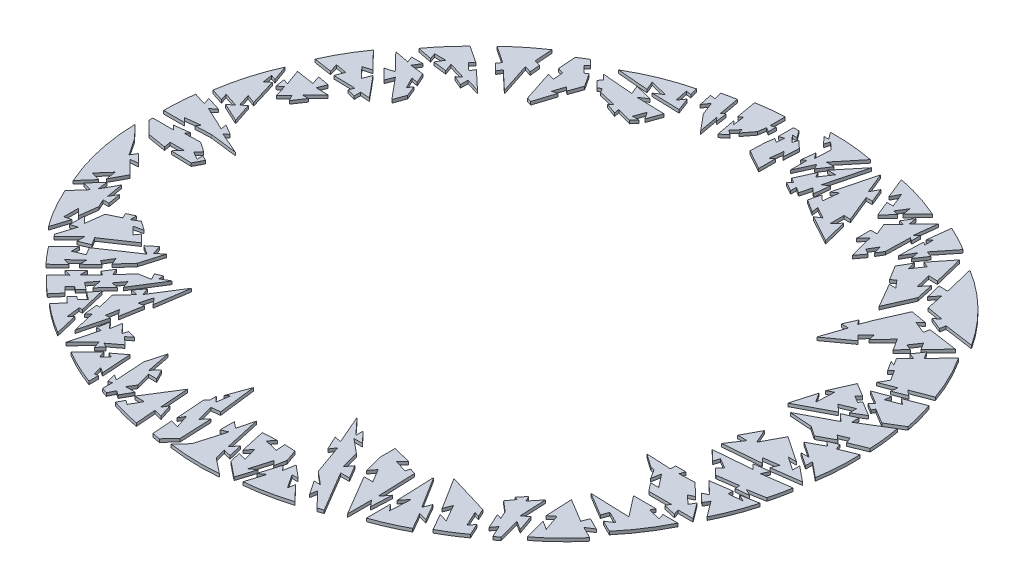
from build123d import *

# Parameters (mm, degrees)
BOSS_EXTRUDE1_DEPTH    = 10
BOSS_EXTRUDE1_2_DEPTH  = 10
BOSS_EXTRUDE1_3_DEPTH  = 10
BOSS_EXTRUDE1_4_DEPTH  = 10
BOSS_EXTRUDE1_5_DEPTH  = 10
BOSS_EXTRUDE1_6_DEPTH  = 10
BOSS_EXTRUDE1_7_DEPTH  = 10
BOSS_EXTRUDE1_8_DEPTH  = 10
BOSS_EXTRUDE1_9_DEPTH  = 10
BOSS_EXTRUDE1_10_DEPTH = 10
BOSS_EXTRUDE1_11_DEPTH = 10
BOSS_EXTRUDE1_12_DEPTH = 10
BOSS_EXTRUDE1_13_DEPTH = 10
BOSS_EXTRUDE1_14_DEPTH = 10
BOSS_EXTRUDE1_15_DEPTH = 10
BOSS_EXTRUDE1_16_DEPTH = 10
BOSS_EXTRUDE1_17_DEPTH = 10
BOSS_EXTRUDE1_18_DEPTH = 10
BOSS_EXTRUDE1_19_DEPTH = 10
BOSS_EXTRUDE1_20_DEPTH = 10
BOSS_EXTRUDE1_21_DEPTH = 10
BOSS_EXTRUDE1_22_DEPTH = 10
BOSS_EXTRUDE1_23_DEPTH = 10
BOSS_EXTRUDE1_24_DEPTH = 10
BOSS_EXTRUDE1_25_DEPTH = 10
BOSS_EXTRUDE1_26_DEPTH = 10
BOSS_EXTRUDE1_27_DEPTH = 10
BOSS_EXTRUDE1_28_DEPTH = 10
BOSS_EXTRUDE1_29_DEPTH = 10
BOSS_EXTRUDE1_30_DEPTH = 10
BOSS_EXTRUDE1_31_DEPTH = 10
BOSS_EXTRUDE1_32_DEPTH = 10
BOSS_EXTRUDE1_33_DEPTH = 10
BOSS_EXTRUDE1_34_DEPTH = 10
BOSS_EXTRUDE1_35_DEPTH = 10
BOSS_EXTRUDE1_36_DEPTH = 10
BOSS_EXTRUDE1_37_DEPTH = 10
BOSS_EXTRUDE1_38_DEPTH = 10
BOSS_EXTRUDE1_39_DEPTH = 10
BOSS_EXTRUDE1_40_DEPTH = 10
BOSS_EXTRUDE1_41_DEPTH = 10
BOSS_EXTRUDE1_42_DEPTH = 10
BOSS_EXTRUDE1_43_DEPTH = 10
BOSS_EXTRUDE1_44_DEPTH = 10
BOSS_EXTRUDE1_45_DEPTH = 10
BOSS_EXTRUDE1_46_DEPTH = 10
BOSS_EXTRUDE1_47_DEPTH = 10
BOSS_EXTRUDE1_48_DEPTH = 10
BOSS_EXTRUDE1_49_DEPTH = 10
BOSS_EXTRUDE1_50_DEPTH = 10
BOSS_EXTRUDE1_51_DEPTH = 10
BOSS_EXTRUDE1_52_DEPTH = 10
BOSS_EXTRUDE1_53_DEPTH = 10
BOSS_EXTRUDE1_54_DEPTH = 10


with BuildPart() as part:
    # Sketch4 → Boss-Extrude1 (new body)
    with BuildSketch(Plane(origin=(0, 0, 0), x_dir=(1, 0, 0), z_dir=(0, 1, 0))):
        Polygon((79.535918804, 1089.89984641), (71.877980686, 1117.12807083), (107.78416964, 1110.626891432), (97.090290147, 1083.298088284), (135.634843477, 1082.410305866), (96.116992272, 1041.040738869), (114.746180978, 1041.040738869), (89.831075163, 1004.643492825), (79.535918804, 1023.411317732), (55.159087046, 998.48275838), (43.82663475, 1035.844579587), (28.102215345, 1023.411317732), (23.557974907, 1054.154102939), (40.33938401, 1047.885655062), (21.89997497, 1098.69712794), align=None)
    extrude(amount=BOSS_EXTRUDE1_DEPTH)


with BuildPart() as body_2:
    # Sketch4 → Boss-Extrude1 2 (new body)
    with BuildSketch(Plane(origin=(0, 0, 0), x_dir=(1, 0, 0), z_dir=(0, 1, 0))):
        with BuildLine():
            Line((73.999706295, 1152.197257873), (66.341768176, 1179.425482293))
            Line((66.341768176, 1179.425482293), (102.247957131, 1172.924302895))
            Line((102.247957131, 1172.924302895), (91.554077638, 1145.595499747))
            Line((91.554077638, 1145.595499747), (160.33816672, 1144.011221304))
            Line((160.33816672, 1144.011221304), (154.163376558, 1128.231202))
            Line((154.163376558, 1128.231202), (180.669740076, 1121.171207079))
            Line((180.669740076, 1121.171207079), (180.669740076, 1142.237518264))
            Line((180.669740076, 1142.237518264), (210.604148879, 1140.084720315))
            Line((210.604148879, 1140.084720315), (154.163376557, 1207.984316562))
            Line((154.163376557, 1207.984316562), (143.671930057, 1181.618520373))
            Line((143.671930057, 1181.618520373), (111.463562372, 1214.997179591))
            Line((111.463562372, 1214.997179591), (138.632262091, 1222.924763886))
            Line((138.632262091, 1222.924763886), (84.294862654, 1279.236513565))
            ThreePointArc((84.294862654, 1279.236513565), (47.302401618, 1221.85451462), (16.363762461, 1160.994539403))
            Line((16.363762461, 1160.994539403), (73.999706295, 1152.197257873))
        make_face()
    extrude(amount=BOSS_EXTRUDE1_2_DEPTH)


with BuildPart() as body_3:
    # Sketch4 → Boss-Extrude1 3 (new body)
    with BuildSketch(Plane(origin=(0, 0, 0), x_dir=(1, 0, 0), z_dir=(0, 1, 0))):
        with BuildLine():
            Line((-9.812041904, 1090.609137792), (8.627367136, 1039.797664915))
            Line((8.627367136, 1039.797664915), (-8.154041967, 1046.066112792))
            Line((-8.154041967, 1046.066112792), (-3.609801529, 1015.323327585))
            Line((-3.609801529, 1015.323327585), (12.114617876, 1027.75658944))
            Line((12.114617876, 1027.75658944), (38.001535619, 942.410331887))
            Line((38.001535619, 942.410331887), (9.800772299, 952.698163999))
            Line((9.800772299, 952.698163999), (22.62263009, 912.692090883))
            Line((22.62263009, 912.692090883), (38.001535619, 925.530778152))
            Line((38.001535619, 925.530778152), (58.119058288, 864.527811369))
            Line((58.119058288, 864.527811369), (-1.285774091, 891.824054133))
            Line((-1.285774091, 891.824054133), (16.201884701, 906.423180311))
            Line((16.201884701, 906.423180311), (-28.71986797, 920.997359875))
            Line((-28.71986797, 920.997359875), (-21.329249717, 898.586566695))
            Line((-21.329249717, 898.586566695), (-61.151464902, 911.506278867))
            ThreePointArc((-61.151464902, 911.506278867), (-41.760391065, 1002.857465389), (-9.812041904, 1090.609137792))
        make_face()
    extrude(amount=BOSS_EXTRUDE1_3_DEPTH)


with BuildPart() as body_4:
    # Sketch4 → Boss-Extrude1 4 (new body)
    with BuildSketch(Plane(origin=(0, 0, 0), x_dir=(1, 0, 0), z_dir=(0, 1, 0))):
        with BuildLine():
            Line((41.755284669, 825.671648231), (-17.64954771, 852.967890995))
            Line((-17.64954771, 852.967890995), (-0.161888919, 867.567017173))
            Line((-0.161888919, 867.567017173), (-45.08364159, 882.141196738))
            Line((-45.08364159, 882.141196738), (-37.693023336, 859.730403558))
            Line((-37.693023336, 859.730403558), (-77.515238522, 872.650115729))
            ThreePointArc((-77.515238522, 872.650115729), (-82.48428339, 824.551990074), (-83.958923932, 776.220359295))
            Line((-83.958923932, 776.220359295), (-17.64954771, 776.220359295))
            Line((-17.64954771, 776.220359295), (-30.992426211, 789.759371705))
            Line((-30.992426211, 789.759371705), (17.187182846, 795.589047432))
            Line((17.187182846, 795.589047432), (8.800814094, 783.929695978))
            Line((8.800814094, 783.929695978), (59.708379146, 785.944138614))
            Line((59.708379146, 785.944138614), (146.47298558, 775.326660929))
            Line((146.47298558, 775.326660929), (76.111994767, 805.792094027))
            Line((76.111994767, 805.792094027), (88.81230015, 816.394620242))
            Line((88.81230015, 816.394620242), (55.819028546, 836.019147527))
            Line((55.819028546, 836.019147527), (59.708379146, 816.394620242))
            Line((59.708379146, 816.394620242), (41.755284669, 825.671648231))
        make_face()
    extrude(amount=BOSS_EXTRUDE1_4_DEPTH)


with BuildPart() as body_5:
    # Sketch4 → Boss-Extrude1 5 (new body)
    with BuildSketch(Plane(origin=(0, 0, 0), x_dir=(1, 0, 0), z_dir=(0, 1, 0))):
        with BuildLine():
            Line((63.201321177, 747.635270536), (12.293756125, 745.6208279))
            Line((12.293756125, 745.6208279), (20.680124878, 757.280179354))
            Line((20.680124878, 757.280179354), (-27.49948418, 751.450503627))
            Line((-27.49948418, 751.450503627), (-14.156605679, 737.911491217))
            Line((-14.156605679, 737.911491217), (-80.465981901, 737.911491217))
            ThreePointArc((-80.465981901, 737.911491217), (-80.403563977, 731.835012314), (-80.285839612, 725.759353269))
            Line((-80.285839612, 725.759353269), (-41.590699559, 686.519703991))
            Line((-41.590699559, 686.519703991), (18.40058862, 676.617529413))
            Line((18.40058862, 676.617529413), (14.850306746, 698.477622804))
            Line((14.850306746, 698.477622804), (59.311970577, 698.477622804))
            Line((59.311970577, 698.477622804), (40.209462988, 676.617529413))
            Line((40.209462988, 676.617529413), (105.564703129, 675.028249911))
            Line((105.564703129, 675.028249911), (121.204736715, 705.133504218))
            Line((121.204736715, 705.133504218), (104.625294103, 713.057913229))
            Line((104.625294103, 713.057913229), (104.625294103, 694.510073667))
            Line((104.625294103, 694.510073667), (79.604936799, 708.929120203))
            Line((79.604936799, 708.929120203), (94.472581963, 725.943018001))
            Line((94.472581963, 725.943018001), (63.201321177, 747.635270536))
        make_face()
    extrude(amount=BOSS_EXTRUDE1_5_DEPTH)


with BuildPart() as body_6:
    # Sketch4 → Boss-Extrude1 6 (new body)
    with BuildSketch(Plane(origin=(0, 0, 0), x_dir=(1, 0, 0), z_dir=(0, 1, 0))):
        with BuildLine():
            Line((-52.556600341, 652.205321241), (-91.251740394, 691.444970519))
            ThreePointArc((-91.251740394, 691.444970519), (-75.321911786, 561.590179275), (-34.373600353, 437.335352248))
            Line((-34.373600353, 437.335352248), (3.884405963, 480.667028893))
            Line((3.884405963, 480.667028893), (-25.122506461, 488.291307388))
            Line((-25.122506461, 488.291307388), (9.542828864, 527.553863014))
            Line((9.542828864, 527.553863014), (14.164803248, 495.389773573))
            Line((14.164803248, 495.389773573), (40.568243027, 543.711075942))
            Line((40.568243027, 543.711075942), (-2.831758419, 587.306096381))
            Line((-2.831758419, 587.306096381), (21.917416148, 589.397681421))
            Line((21.917416148, 589.397681421), (-4.757646195, 616.192608824))
            Line((-4.757646195, 616.192608824), (-16.190600365, 597.717205565))
            Line((-16.190600365, 597.717205565), (-52.556600341, 652.205321241))
        make_face()
    extrude(amount=BOSS_EXTRUDE1_6_DEPTH)


with BuildPart() as body_7:
    # Sketch4 → Boss-Extrude1 7 (new body)
    with BuildSketch(Plane(origin=(0, 0, 0), x_dir=(1, 0, 0), z_dir=(0, 1, 0))):
        with BuildLine():
            Line((-19.571437773, 396.330662033), (18.686568543, 439.662338678))
            Line((18.686568543, 439.662338678), (-10.320343881, 447.286617173))
            Line((-10.320343881, 447.286617173), (24.344991444, 486.549172799))
            Line((24.344991444, 486.549172799), (28.966965828, 454.385083358))
            Line((28.966965828, 454.385083358), (55.370405607, 502.706385727))
            Line((55.370405607, 502.706385727), (64.432670674, 448.572139031))
            Line((64.432670674, 448.572139031), (78.734381674, 472.433119398))
            Line((78.734381674, 472.433119398), (85.585678741, 431.506286776))
            Line((85.585678741, 431.506286776), (67.037582974, 431.506286776))
            Line((67.037582974, 431.506286776), (78.734381674, 406.220835552))
            Line((78.734381674, 406.220835552), (71.583526174, 348.230587538))
            Line((71.583526174, 348.230587538), (50.972862348, 368.129202053))
            Line((50.972862348, 368.129202053), (50.972862348, 321.225324983))
            Line((50.972862348, 321.225324983), (71.583526174, 327.479175259))
            Line((71.583526174, 327.479175259), (53.608531611, 270.245049446))
            ThreePointArc((53.608531611, 270.245049446), (13.566646481, 331.284376015), (-19.571437773, 396.330662033))
        make_face()
    extrude(amount=BOSS_EXTRUDE1_7_DEPTH)


with BuildPart() as body_8:
    # Sketch4 → Boss-Extrude1 8 (new body)
    with BuildSketch(Plane(origin=(0, 0, 0), x_dir=(1, 0, 0), z_dir=(0, 1, 0))):
        with BuildLine():
            Line((109.822945882, 394.728710427), (102.672090382, 336.738462413))
            Line((102.672090382, 336.738462413), (82.061426556, 356.637076928))
            Line((82.061426556, 356.637076928), (82.061426556, 309.733199858))
            Line((82.061426556, 309.733199858), (102.672090382, 315.987050134))
            Line((102.672090382, 315.987050134), (84.697095819, 258.752924321))
            ThreePointArc((84.697095819, 258.752924321), (87.136193554, 255.465641704), (89.595400608, 252.193375603))
            Line((89.595400608, 252.193375603), (139.578412803, 301.336922603))
            Line((139.578412803, 301.336922603), (139.578412803, 275.103258044))
            Line((139.578412803, 275.103258044), (173.135786031, 289.249418825))
            Line((173.135786031, 289.249418825), (158.264865702, 313.424426381))
            Line((158.264865702, 313.424426381), (247.693361962, 373.844534244))
            Line((247.693361962, 373.844534244), (223.355119625, 398.598520021))
            Line((223.355119625, 398.598520021), (212.025749305, 382.407264927))
            Line((212.025749305, 382.407264927), (188.552899834, 406.281075284))
            Line((188.552899834, 406.281075284), (216.530458883, 413.302784209))
            Line((216.530458883, 413.302784209), (187.396758953, 433.688262256))
            Line((187.396758953, 433.688262256), (165.167369095, 420.014161648))
            Line((165.167369095, 420.014161648), (165.167369095, 441.003339135))
            Line((165.167369095, 441.003339135), (140.750323542, 429.254882222))
            Line((140.750323542, 429.254882222), (148.425803186, 413.302784213))
            Line((148.425803186, 413.302784213), (109.822945882, 394.728710427))
        make_face()
    extrude(amount=BOSS_EXTRUDE1_8_DEPTH)


with BuildPart() as body_9:
    # Sketch4 → Boss-Extrude1 9 (new body)
    with BuildSketch(Plane(origin=(0, 0, 0), x_dir=(1, 0, 0), z_dir=(0, 1, 0))):
        with BuildLine():
            Line((177.328299857, 276.862381203), (287.560333038, 351.337874064))
            Line((287.560333038, 351.337874064), (259.255499242, 369.719030106))
            Line((259.255499242, 369.719030106), (287.056489781, 392.692837047))
            Line((287.056489781, 392.692837047), (295.817750845, 363.640182742))
            Line((295.817750845, 363.640182742), (318.729469632, 382.573659352))
            Line((318.729469632, 382.573659352), (297.315557908, 310.622095472))
            Line((297.315557908, 310.622095472), (259.255499242, 268.030936848))
            Line((259.255499242, 268.030936848), (250.229433273, 289.32651616))
            Line((250.229433273, 289.32651616), (231.089183461, 259.133799897))
            Line((231.089183461, 259.133799897), (244.735949045, 250.482623894))
            Line((244.735949045, 250.482623894), (207.616333989, 215.631330425))
            Line((207.616333989, 215.631330425), (207.616333989, 238.541212866))
            Line((207.616333989, 238.541212866), (170.990191574, 204.153236698))
            Line((170.990191574, 204.153236698), (192.228086744, 197.832506642))
            Line((192.228086744, 197.832506642), (153.904476449, 161.93124548))
            ThreePointArc((153.904476449, 161.93124548), (130.575141478, 188.186006118), (108.658834763, 215.631330425))
            Line((108.658834763, 215.631330425), (158.641846957, 264.774877425))
            Line((158.641846957, 264.774877425), (158.641846957, 238.541212866))
            Line((158.641846957, 238.541212866), (192.199220185, 252.687373647))
            Line((192.199220185, 252.687373647), (177.328299857, 276.862381203))
        make_face()
    extrude(amount=BOSS_EXTRUDE1_9_DEPTH)


with BuildPart() as body_10:
    # Sketch4 → Boss-Extrude1 10 (new body)
    with BuildSketch(Plane(origin=(0, 0, 0), x_dir=(1, 0, 0), z_dir=(0, 1, 0))):
        with BuildLine():
            Line((327.70308918, 282.051288062), (364.751276434, 288.716386461))
            Line((364.751276434, 288.716386461), (354.124045758, 308.711681656))
            Line((354.124045758, 308.711681656), (375.31883397, 317.274412339))
            Line((375.31883397, 317.274412339), (375.31883397, 302.046583258))
            Line((375.31883397, 302.046583258), (402.174953977, 317.274412339))
            Line((402.174953977, 317.274412339), (341.827496185, 221.911816484))
            Line((341.827496185, 221.911816484), (333.187935626, 244.60034727))
            Line((333.187935626, 244.60034727), (311.480436944, 216.033324286))
            Line((311.480436944, 216.033324286), (332.310723281, 211.70060793))
            Line((332.310723281, 211.70060793), (294.437547572, 171.350848224))
            Line((294.437547572, 171.350848224), (287.39528718, 201.184587801))
            Line((287.39528718, 201.184587801), (265.981424309, 173.003988932))
            Line((265.981424309, 173.003988932), (288.204302366, 156.117276712))
            Line((288.204302366, 156.117276712), (271.512078315, 138.333522991))
            Line((271.512078315, 138.333522991), (261.476714732, 145.959191296))
            Line((261.476714732, 145.959191296), (246.191839965, 129.674815549))
            Line((246.191839965, 129.674815549), (264.310936897, 112.667830952))
            Line((264.310936897, 112.667830952), (238.114039669, 81.973024041))
            ThreePointArc((238.114039669, 81.973024041), (210.486494325, 106.916254166), (184.292007721, 133.36043807))
            Line((184.292007721, 133.36043807), (222.615618017, 169.261699232))
            Line((222.615618017, 169.261699232), (201.377722846, 175.582429288))
            Line((201.377722846, 175.582429288), (238.003865261, 209.970405456))
            Line((238.003865261, 209.970405456), (238.003865261, 187.060523016))
            Line((238.003865261, 187.060523016), (275.123480318, 221.911816484))
            Line((275.123480318, 221.911816484), (261.476714733, 230.562992488))
            Line((261.476714733, 230.562992488), (280.616964545, 260.75570875))
            Line((280.616964545, 260.75570875), (289.643030515, 239.460129438))
            Line((289.643030515, 239.460129438), (327.70308918, 282.051288062))
        make_face()
    extrude(amount=BOSS_EXTRUDE1_10_DEPTH)


with BuildPart() as body_11:
    # Sketch4 → Boss-Extrude1 11 (new body)
    with BuildSketch(Plane(origin=(0, 0, 0), x_dir=(1, 0, 0), z_dir=(0, 1, 0))):
        with BuildLine():
            Line((318.166013938, 177.340107138), (337.825903788, 94.053207594))
            Line((337.825903788, 94.053207594), (327.915054147, 94.053207594))
            Line((327.915054147, 94.053207594), (332.870478967, 49.672476542))
            Line((332.870478967, 49.672476542), (344.974139966, 63.770513588))
            Line((344.974139966, 63.770513588), (362.02301673, -8.455124358))
            ThreePointArc((362.02301673, -8.455124358), (314.023937786, 22.836468328), (268.884766427, 58.128543378))
            Line((268.884766427, 58.128543378), (295.081663655, 88.823350289))
            Line((295.081663655, 88.823350289), (276.962566723, 105.830334886))
            Line((276.962566723, 105.830334886), (292.24744149, 122.114710633))
            Line((292.24744149, 122.114710633), (302.282805073, 114.489042328))
            Line((302.282805073, 114.489042328), (318.975029125, 132.272796048))
            Line((318.975029125, 132.272796048), (296.752151067, 149.159508269))
            Line((296.752151067, 149.159508269), (318.166013938, 177.340107138))
        make_face()
    extrude(amount=BOSS_EXTRUDE1_11_DEPTH)


with BuildPart() as body_12:
    # Sketch4 → Boss-Extrude1 12 (new body)
    with BuildSketch(Plane(origin=(0, 0, 0), x_dir=(1, 0, 0), z_dir=(0, 1, 0))):
        Polygon((440.498310755, 119.89124082), (434.362277889, 83.862911401), (416.970747284, 104.637864354), (410.557984152, 66.984685558), (425.666512586, 66.984685558), (402.567799624, -22.311145191), (454.368370737, 31.63761816), (461.788637842, 9.142700204), (480.245411042, 28.364883825), (465.648935655, 35.81645571), (503.643461314, 64.677028911), (480.245411042, 87.14338943), (498.004315831, 100.633021495), (472.947173349, 108.258689801), (467.859020429, 91.539555481), align=None)
    extrude(amount=BOSS_EXTRUDE1_12_DEPTH)


with BuildPart() as body_13:
    # Sketch4 → Boss-Extrude1 13 (new body)
    with BuildSketch(Plane(origin=(0, 0, 0), x_dir=(1, 0, 0), z_dir=(0, 1, 0))):
        Polygon((453.586838126, 328.489580376), (393.239380335, 233.126984521), (384.599819775, 255.815515307), (362.892321093, 227.248492323), (383.722607431, 222.915775967), (345.849431722, 182.566016261), (358.467061179, 129.112856295), (348.556211538, 129.112856295), (353.511636359, 84.732125242), (365.615297358, 98.830162288), (382.664174122, 26.604524342), (405.762887084, 115.900355091), (390.654358649, 115.900355091), (397.067121782, 153.553533886), (414.458652386, 132.778580934), (426.73071812, 204.835239772), (408.78101236, 201.353975417), (420.136292413, 241.778160525), (437.375157329, 221.185573494), align=None)
    extrude(amount=BOSS_EXTRUDE1_13_DEPTH)


with BuildPart() as body_14:
    # Sketch4 → Boss-Extrude1 14 (new body)
    with BuildSketch(Plane(origin=(0, 0, 0), x_dir=(1, 0, 0), z_dir=(0, 1, 0))):
        with BuildLine():
            Line((489.742094149, 12.273940855), (437.941523036, -41.674822496))
            ThreePointArc((437.941523036, -41.674822496), (491.16768175, -70.03860688), (546.736395575, -93.483143126))
            Line((546.736395575, -93.483143126), (546.736395575, -62.19675071))
            Line((546.736395575, -62.19675071), (535.564101531, -65.135540554))
            Line((535.564101531, -65.135540554), (528.248609071, -37.324490024))
            Line((528.248609071, -37.324490024), (545.156477876, -48.127129486))
            Line((545.156477876, -48.127129486), (539.017184726, 45.313351605))
            Line((539.017184726, 45.313351605), (501.022659067, 16.452778404))
            Line((501.022659067, 16.452778404), (515.619134454, 9.00120652))
            Line((515.619134454, 9.00120652), (497.162361254, -10.220977101))
            Line((497.162361254, -10.220977101), (489.742094149, 12.273940855))
        make_face()
    extrude(amount=BOSS_EXTRUDE1_14_DEPTH)


with BuildPart() as body_15:
    # Sketch4 → Boss-Extrude1 15 (new body)
    with BuildSketch(Plane(origin=(0, 0, 0), x_dir=(1, 0, 0), z_dir=(0, 1, 0))):
        with BuildLine():
            Line((597.756001684, 108.00042712), (581.032826563, 47.251068685))
            Line((581.032826563, 47.251068685), (587.172119713, -46.189412406))
            Line((587.172119713, -46.189412406), (570.264250907, -35.386772944))
            Line((570.264250907, -35.386772944), (577.579743368, -63.197823474))
            Line((577.579743368, -63.197823474), (588.752037411, -60.259033631))
            Line((588.752037411, -60.259033631), (588.752037411, -91.545426046))
            ThreePointArc((588.752037411, -91.545426046), (597.794046725, -94.813854886), (606.88218713, -97.951730517))
            Line((606.88218713, -97.951730517), (617.905643605, -75.652462449))
            Line((617.905643605, -75.652462449), (631.309529351, -85.114807861))
            Line((631.309529351, -85.114807861), (651.337142246, -49.946424082))
            Line((651.337142246, -49.946424082), (620.742873159, -49.946424082))
            Line((620.742873159, -49.946424082), (635.69831428, -26.122390484))
            Line((635.69831428, -26.122390484), (622.559710316, 21.30934487))
            Line((622.559710316, 21.30934487), (648.836918243, 21.30934487))
            Line((648.836918243, 21.30934487), (632.459338173, 53.612416389))
            Line((632.459338173, 53.612416389), (612.66008246, 32.48853253))
            Line((612.66008246, 32.48853253), (597.756001684, 108.00042712))
        make_face()
    extrude(amount=BOSS_EXTRUDE1_15_DEPTH)


with BuildPart() as body_16:
    # Sketch4 → Boss-Extrude1 16 (new body)
    with BuildSketch(Plane(origin=(0, 0, 0), x_dir=(1, 0, 0), z_dir=(0, 1, 0))):
        with BuildLine():
            Line((647.780592753, -109.705430187), (658.804049228, -87.406162119))
            Line((658.804049228, -87.406162119), (672.207934973, -96.868507531))
            Line((672.207934973, -96.868507531), (692.235547869, -61.700123752))
            Line((692.235547869, -61.700123752), (661.641278782, -61.700123752))
            Line((661.641278782, -61.700123752), (726.649923722, 41.858716719))
            Line((726.649923722, 41.858716719), (733.495541865, -51.490805086))
            Line((733.495541865, -51.490805086), (744.71711675, -31.785778121))
            Line((744.71711675, -31.785778121), (758.630692934, -74.951523144))
            Line((758.630692934, -74.951523144), (733.495541865, -68.638419609))
            Line((733.495541865, -68.638419609), (738.237609782, -133.303109214))
            ThreePointArc((738.237609782, -133.303109214), (692.595554153, -123.089520451), (647.780592753, -109.705430187))
        make_face()
    extrude(amount=BOSS_EXTRUDE1_16_DEPTH)


with BuildPart() as body_17:
    # Sketch4 → Boss-Extrude1 17 (new body)
    with BuildSketch(Plane(origin=(0, 0, 0), x_dir=(1, 0, 0), z_dir=(0, 1, 0))):
        with BuildLine():
            Line((782.552631596, 38.688364905), (789.398249739, -54.6611569))
            Line((789.398249739, -54.6611569), (800.619824624, -34.956129935))
            Line((800.619824624, -34.956129935), (814.533400807, -78.121874958))
            Line((814.533400807, -78.121874958), (789.398249739, -71.808771423))
            Line((789.398249739, -71.808771423), (794.140317656, -136.473461028))
            ThreePointArc((794.140317656, -136.473461028), (806.599402219, -138.684513709), (819.098154532, -140.659034599))
            Line((819.098154532, -140.659034599), (851.265580891, -106.46947753))
            Line((851.265580891, -106.46947753), (846.938956692, -3.63292302))
            Line((846.938956692, -3.63292302), (828.52228932, -23.207311505))
            Line((828.52228932, -23.207311505), (814.533400807, 28.882089071))
            Line((814.533400807, 28.882089071), (842.511177833, 32.327017201))
            Line((842.511177833, 32.327017201), (827.792816748, 151.861303279))
            Line((827.792816748, 151.861303279), (802.578753671, 82.068276866))
            Line((802.578753671, 82.068276866), (814.533400807, 93.076375636))
            Line((814.533400807, 93.076375636), (807.922846758, 51.532893876))
            Line((807.922846758, 51.532893876), (792.498976172, 68.283009785))
            Line((792.498976172, 68.283009785), (792.498976172, 47.847175052))
            Line((792.498976172, 47.847175052), (782.552631596, 38.688364905))
        make_face()
    extrude(amount=BOSS_EXTRUDE1_17_DEPTH)


with BuildPart() as body_18:
    # Sketch4 → Boss-Extrude1 18 (new body)
    with BuildSketch(Plane(origin=(0, 0, 0), x_dir=(1, 0, 0), z_dir=(0, 1, 0))):
        with BuildLine():
            Line((884.602016416, -102.333419462), (852.434590057, -136.522976531))
            ThreePointArc((852.434590057, -136.522976531), (931.784660081, -143.484991445), (1011.399113101, -140.946855336))
            Line((1011.399113101, -140.946855336), (963.053557631, -102.333419461))
            Line((963.053557631, -102.333419461), (954.348325388, -67.672713355))
            Line((954.348325388, -67.672713355), (979.224438091, -73.985816891))
            Line((979.224438091, -73.985816891), (968.383117253, -30.820071867))
            Line((968.383117253, -30.820071867), (951.144948085, -52.402944379))
            Line((951.144948085, -52.402944379), (925.387529898, 63.325601839))
            Line((925.387529898, 63.325601839), (911.986774571, 10.521351454))
            Line((911.986774571, 10.521351454), (891.594594978, 26.80851811))
            Line((891.594594978, 26.80851811), (891.594594978, -19.071253437))
            Line((891.594594978, -19.071253437), (911.98677457, -9.642090648))
            Line((911.98677457, -9.642090648), (884.602016416, -102.333419462))
        make_face()
    extrude(amount=BOSS_EXTRUDE1_18_DEPTH)


with BuildPart() as body_19:
    # Sketch4 → Boss-Extrude1 19 (new body)
    with BuildSketch(Plane(origin=(0, 0, 0), x_dir=(1, 0, 0), z_dir=(0, 1, 0))):
        Polygon((1044.57890519, -126.957258536), (996.23334972, -88.343822661), (987.528117477, -53.683116555), (1012.40423018, -59.996220091), (1001.562909342, -16.830475067), (984.324740174, -38.413347579), (966.69483959, 40.79811491), (1012.40423018, 44.001835341), (996.23334972, 24.510948253), (1038.093918319, 14.492731847), (1036.025658022, 44.001835341), (1069.991151147, 42.399975125), (1083.462745391, 4.347506152), (1076.717688071, -32.185169561), (1063.014065545, -16.830475067), (1043.786001521, -81.913204478), (1063.014065546, -68.041575069), align=None)
    extrude(amount=BOSS_EXTRUDE1_19_DEPTH)


with BuildPart() as body_20:
    # Sketch4 → Boss-Extrude1 20 (new body)
    with BuildSketch(Plane(origin=(0, 0, 0), x_dir=(1, 0, 0), z_dir=(0, 1, 0))):
        with BuildLine():
            Line((1110.807699052, 5.503034447), (1104.062641732, -31.029641267))
            Line((1104.062641732, -31.029641267), (1090.359019206, -15.674946773))
            Line((1090.359019206, -15.674946773), (1071.130955182, -80.757676183))
            Line((1071.130955182, -80.757676183), (1090.359019207, -66.886046775))
            Line((1090.359019207, -66.886046775), (1071.923858851, -125.801730242))
            ThreePointArc((1071.923858851, -125.801730242), (1141.908204974, -115.614287968), (1210.422219434, -98.08081983))
            Line((1210.422219434, -98.08081983), (1164.051494151, -49.70765153))
            Line((1164.051494151, -49.70765153), (1160.065743558, -71.295330772))
            Line((1160.065743558, -71.295330772), (1130.953952711, -28.119972287))
            Line((1130.953952711, -28.119972287), (1151.100206369, -28.119972287))
            Line((1151.100206369, -28.119972287), (1110.807699052, 5.503034447))
        make_face()
    extrude(amount=BOSS_EXTRUDE1_20_DEPTH)


with BuildPart() as body_21:
    # Sketch4 → Boss-Extrude1 21 (new body)
    with BuildSketch(Plane(origin=(0, 0, 0), x_dir=(1, 0, 0), z_dir=(0, 1, 0))):
        with BuildLine():
            Line((1076.268303777, 235.261251134), (1116.740927045, 141.457772216))
            Line((1116.740927045, 141.457772216), (1095.947036983, 145.296964874))
            Line((1095.947036983, 145.296964874), (1116.740927045, 100.724720291))
            Line((1116.740927045, 100.724720291), (1129.565495047, 119.483072291))
            Line((1129.565495047, 119.483072291), (1163.497699448, 23.63664671))
            Line((1163.497699448, 23.63664671), (1203.790206765, -9.986360023))
            Line((1203.790206765, -9.986360023), (1183.643953107, -9.986360023))
            Line((1183.643953107, -9.986360023), (1212.755743954, -53.161718508))
            Line((1212.755743954, -53.161718508), (1216.741494547, -31.574039266))
            Line((1216.741494547, -31.574039266), (1263.11221983, -79.947207567))
            ThreePointArc((1263.11221983, -79.947207567), (1271.745637186, -77.178687897), (1280.340661817, -74.293181357))
            Line((1280.340661817, -74.293181357), (1203.790206765, 54.979276472))
            Line((1203.790206765, 54.979276472), (1231.898535757, 54.979276472))
            Line((1231.898535757, 54.979276472), (1206.61987732, 97.667909798))
            Line((1206.61987732, 97.667909798), (1190.617232161, 76.323593134))
            Line((1190.617232161, 76.323593134), (1175.434449447, 133.785551215))
            Line((1175.434449447, 133.785551215), (1129.565495046, 171.520084351))
            Line((1129.565495046, 171.520084351), (1156.752642128, 171.520084351))
            Line((1156.752642128, 171.520084351), (1123.820955578, 206.824411658))
            Line((1123.820955578, 206.824411658), (1123.820955578, 183.397606506))
            Line((1123.820955578, 183.397606506), (1076.268303777, 235.261251134))
        make_face()
    extrude(amount=BOSS_EXTRUDE1_21_DEPTH)


with BuildPart() as body_22:
    # Sketch4 → Boss-Extrude1 22 (new body)
    with BuildSketch(Plane(origin=(0, 0, 0), x_dir=(1, 0, 0), z_dir=(0, 1, 0))):
        Polygon((1328.253317478, -47.551346462), (1251.702862426, 81.721111367), (1279.811191418, 81.721111367), (1254.532532981, 124.409744694), (1238.529887822, 103.06542803), (1223.347105108, 160.52738611), (1223.347105108, 210.139441401), (1280.930053831, 195.290704916), (1260.668399615, 175.839245837), (1301.273210362, 163.639073676), (1305.429896458, 177.473423718), (1323.517499978, 172.038799769), (1328.253317478, 50.378481605), (1348.364325266, 76.079141157), (1345.281859295, 9.495473421), (1328.253317478, 29.200500386), align=None)
    extrude(amount=BOSS_EXTRUDE1_22_DEPTH)


with BuildPart() as body_23:
    # Sketch4 → Boss-Extrude1 23 (new body)
    with BuildSketch(Plane(origin=(0, 0, 0), x_dir=(1, 0, 0), z_dir=(0, 1, 0))):
        with BuildLine():
            Line((1370.214663969, -28.854267708), (1370.214663969, 47.89757914))
            Line((1370.214663969, 47.89757914), (1387.243205787, 28.192552175))
            Line((1387.243205787, 28.192552175), (1390.325671758, 94.776219911))
            Line((1390.325671758, 94.776219911), (1370.214663969, 69.075560359))
            Line((1370.214663969, 69.075560359), (1365.478846469, 190.735878523))
            Line((1365.478846469, 190.735878523), (1429.062215955, 89.239002461))
            Line((1429.062215955, 89.239002461), (1439.184850757, 115.180726276))
            Line((1439.184850757, 115.180726276), (1470.040145767, 61.484386043))
            Line((1470.040145767, 61.484386043), (1442.751358467, 69.07556036))
            Line((1442.751358467, 69.07556036), (1473.006681651, 16.42332913))
            ThreePointArc((1473.006681651, 16.42332913), (1422.56457242, -8.381071539), (1370.214663969, -28.854267708))
        make_face()
    extrude(amount=BOSS_EXTRUDE1_23_DEPTH)


with BuildPart() as body_24:
    # Sketch4 → Boss-Extrude1 24 (new body)
    with BuildSketch(Plane(origin=(0, 0, 0), x_dir=(1, 0, 0), z_dir=(0, 1, 0))):
        with BuildLine():
            Line((1400.966120484, 220.398801671), (1464.54948997, 118.901925608))
            Line((1464.54948997, 118.901925608), (1474.672124772, 144.843649424))
            Line((1474.672124772, 144.843649424), (1505.527419781, 91.147309191))
            Line((1505.527419781, 91.147309191), (1478.238632482, 98.738483507))
            Line((1478.238632482, 98.738483507), (1508.493955665, 46.086252277))
            ThreePointArc((1508.493955665, 46.086252277), (1545.878602464, 68.071763614), (1581.756876595, 92.438215354))
            Line((1581.756876595, 92.438215354), (1564.492489315, 130.081113269))
            Line((1564.492489315, 130.081113269), (1550.776175067, 111.804238677))
            Line((1550.776175067, 111.804238677), (1528.505009856, 160.363807277))
            Line((1528.505009856, 160.363807277), (1544.531895303, 155.133949972))
            Line((1544.531895303, 155.133949972), (1532.760685548, 180.799642011))
            Line((1532.760685548, 180.799642011), (1400.966120484, 220.398801671))
        make_face()
    extrude(amount=BOSS_EXTRUDE1_24_DEPTH)


with BuildPart() as body_25:
    # Sketch4 → Boss-Extrude1 25 (new body)
    with BuildSketch(Plane(origin=(0, 0, 0), x_dir=(1, 0, 0), z_dir=(0, 1, 0))):
        with BuildLine():
            Line((1574.327067301, 210.766646336), (1586.098277057, 185.100954297))
            Line((1586.098277057, 185.100954297), (1570.07139161, 190.330811602))
            Line((1570.07139161, 190.330811602), (1592.342556821, 141.771243002))
            Line((1592.342556821, 141.771243002), (1606.058871068, 160.048117594))
            Line((1606.058871068, 160.048117594), (1623.323258348, 122.40521968))
            ThreePointArc((1623.323258348, 122.40521968), (1630.990166337, 128.068598531), (1638.575436689, 133.84086081))
            Line((1638.575436689, 133.84086081), (1620.114700257, 202.736750921))
            Line((1620.114700257, 202.736750921), (1648.017053479, 185.100954297))
            Line((1648.017053479, 185.100954297), (1629.345068473, 238.409920708))
            Line((1629.345068473, 238.409920708), (1610.122761197, 222.826448619))
            Line((1610.122761197, 222.826448619), (1606.058871068, 307.483011614))
            Line((1606.058871068, 307.483011614), (1578.423515705, 273.617711143))
            Line((1578.423515705, 273.617711143), (1570.07139161, 290.550361378))
            Line((1570.07139161, 290.550361378), (1550.0807851, 266.053195079))
            Line((1550.0807851, 266.053195079), (1560.076088355, 263.697430722))
            Line((1560.076088355, 263.697430722), (1541.850417449, 238.409920708))
            Line((1541.850417449, 238.409920708), (1574.327067301, 210.766646336))
        make_face()
    extrude(amount=BOSS_EXTRUDE1_25_DEPTH)


with BuildPart() as body_26:
    # Sketch4 → Boss-Extrude1 26 (new body)
    with BuildSketch(Plane(origin=(0, 0, 0), x_dir=(1, 0, 0), z_dir=(0, 1, 0))):
        with BuildLine():
            Line((1679.610097785, 176.36371596), (1661.149361354, 245.25960607))
            Line((1661.149361354, 245.25960607), (1689.051714575, 227.623809446))
            Line((1689.051714575, 227.623809446), (1670.379729569, 280.932775857))
            Line((1670.379729569, 280.932775857), (1651.157422294, 265.349303768))
            Line((1651.157422294, 265.349303768), (1647.093532164, 350.005866763))
            Line((1647.093532164, 350.005866763), (1721.94726423, 305.094785872))
            Line((1721.94726423, 305.094785872), (1730.322374569, 327.550326317))
            Line((1730.322374569, 327.550326317), (1768.11027302, 308.576050229))
            Line((1768.11027302, 308.576050229), (1744.12176992, 292.888661148))
            Line((1744.12176992, 292.888661148), (1781.644043339, 274.047762222))
            ThreePointArc((1781.644043339, 274.047762222), (1733.2178635, 222.499577382), (1679.610097785, 176.36371596))
        make_face()
    extrude(amount=BOSS_EXTRUDE1_26_DEPTH)


with BuildPart() as body_27:
    # Sketch4 → Boss-Extrude1 27 (new body)
    with BuildSketch(Plane(origin=(0, 0, 0), x_dir=(1, 0, 0), z_dir=(0, 1, 0))):
        with BuildLine():
            Line((1735.67579247, 460.285117576), (1786.913299267, 394.420574957))
            Line((1786.913299267, 394.420574957), (1660.822060404, 398.907470746))
            Line((1660.822060404, 398.907470746), (1735.67579247, 353.996389855))
            Line((1735.67579247, 353.996389855), (1744.050902809, 376.451930301))
            Line((1744.050902809, 376.451930301), (1781.838801259, 357.477654212))
            Line((1781.838801259, 357.477654212), (1757.85029816, 341.790265131))
            Line((1757.85029816, 341.790265131), (1795.372571579, 322.949366205))
            ThreePointArc((1795.372571579, 322.949366205), (1842.899394015, 386.559198779), (1882.537895227, 455.361806816))
            Line((1882.537895227, 455.361806816), (1834.676392465, 455.361806816))
            Line((1834.676392465, 455.361806816), (1840.470169468, 437.636716572))
            Line((1840.470169468, 437.636716572), (1800.703790949, 446.499261689))
            Line((1800.703790949, 446.499261689), (1807.814335452, 460.285117576))
            Line((1807.814335452, 460.285117576), (1735.67579247, 460.285117576))
        make_face()
    extrude(amount=BOSS_EXTRUDE1_27_DEPTH)


with BuildPart() as body_28:
    # Sketch4 → Boss-Extrude1 28 (new body)
    with BuildSketch(Plane(origin=(0, 0, 0), x_dir=(1, 0, 0), z_dir=(0, 1, 0))):
        Polygon((1684.326934096, 567.25794866), (1696.442030931, 565.488005204), (1714.701048177, 536.104471118), (1720.340993348, 565.488005211), (1753.045124842, 523.44765631), (1727.106484749, 523.44765631), (1747.596597837, 497.108124762), (1819.735140819, 497.108124762), (1812.624596316, 483.322268875), (1852.390974835, 474.459723758), (1846.597197832, 492.184814002), (1894.458700594, 492.184814002), (1857.3442142, 541.828812357), (1846.597197832, 523.447656315), (1819.735140824, 548.850521285), (1837.379825332, 557.416076292), (1796.876241354, 595.719437582), (1747.596597844, 593.813931674), (1753.045124851, 610.264160123), (1720.340993348, 610.264160123), (1720.340993348, 593.813931654), (1641.011062005, 597.624943485), align=None)
    extrude(amount=BOSS_EXTRUDE1_28_DEPTH)


with BuildPart() as body_29:
    # Sketch4 → Boss-Extrude1 29 (new body)
    with BuildSketch(Plane(origin=(0, 0, 0), x_dir=(1, 0, 0), z_dir=(0, 1, 0))):
        with BuildLine():
            Line((1911.864948183, 519.321763268), (1874.750461789, 568.965761623))
            Line((1874.750461789, 568.965761623), (1864.003445421, 550.584605581))
            Line((1864.003445421, 550.584605581), (1837.141388413, 575.987470551))
            Line((1837.141388413, 575.987470551), (1854.786072921, 584.553025558))
            Line((1854.786072921, 584.553025558), (1814.282488943, 622.856386848))
            Line((1814.282488943, 622.856386848), (1881.861861218, 632.233992236))
            Line((1881.861861218, 632.233992236), (1881.861861218, 616.79784613))
            Line((1881.861861218, 616.79784613), (1924.8747808, 620.95088093))
            Line((1924.8747808, 620.95088093), (1903.368321002, 632.233992237))
            Line((1903.368321002, 632.233992237), (1958.63467541, 641.77430934))
            ThreePointArc((1958.63467541, 641.77430934), (1938.262393956, 579.39740571), (1911.864948183, 519.321763268))
        make_face()
    extrude(amount=BOSS_EXTRUDE1_29_DEPTH)


with BuildPart() as body_30:
    # Sketch4 → Boss-Extrude1 30 (new body)
    with BuildSketch(Plane(origin=(0, 0, 0), x_dir=(1, 0, 0), z_dir=(0, 1, 0))):
        with BuildLine():
            Line((1810.112670552, 648.958787446), (1790.10806426, 667.876709936))
            Line((1790.10806426, 667.876709936), (1804.53246232, 683.12967465))
            Line((1804.53246232, 683.12967465), (1772.013555206, 702.142691363))
            Line((1772.013555206, 702.142691363), (1766.281554043, 683.129674651))
            Line((1766.281554043, 683.129674651), (1733.577422551, 714.05726281))
            Line((1733.577422551, 714.05726281), (1853.376017565, 724.332257459))
            Line((1853.376017565, 724.332257459), (1838.29776495, 740.059667592))
            Line((1838.29776495, 740.059667592), (1887.40941492, 746.874612121))
            Line((1887.40941492, 746.874612121), (1877.692042819, 724.332257491))
            Line((1877.692042819, 724.332257491), (1969.463136857, 737.066810609))
            ThreePointArc((1969.463136857, 737.066810609), (1962.881797134, 702.272809498), (1954.464857019, 667.876709939))
            Line((1954.464857019, 667.876709939), (1899.198502611, 658.336392836))
            Line((1899.198502611, 658.336392836), (1920.704962409, 647.053281529))
            Line((1920.704962409, 647.053281529), (1877.692042827, 642.900246729))
            Line((1877.692042827, 642.900246729), (1877.692042827, 658.336392834))
            Line((1877.692042827, 658.336392834), (1810.112670552, 648.958787446))
        make_face()
    extrude(amount=BOSS_EXTRUDE1_30_DEPTH)


with BuildPart() as body_31:
    # Sketch4 → Boss-Extrude1 31 (new body)
    with BuildSketch(Plane(origin=(0, 0, 0), x_dir=(1, 0, 0), z_dir=(0, 1, 0))):
        Polygon((1967.526614562, 769.090354623), (1875.755520524, 756.355801506), (1885.472892625, 778.898156136), (1836.361242655, 772.083211607), (1851.43949527, 756.355801473), (1731.640900256, 746.080806825), (1764.345031753, 794.580820832), (1734.844911526, 794.580820832), (1764.345031753, 850.074753651), (1784.530458389, 805.832125747), (1819.182323706, 871.017225713), (1901.811483565, 815.29940862), (1875.755520526, 815.29940862), (1918.768440108, 786.295289614), (1918.768440108, 808.878853741), align=None)
    extrude(amount=BOSS_EXTRUDE1_31_DEPTH)


with BuildPart() as body_32:
    # Sketch4 → Boss-Extrude1 32 (new body)
    with BuildSketch(Plane(origin=(0, 0, 0), x_dir=(1, 0, 0), z_dir=(0, 1, 0))):
        with BuildLine():
            Line((1860.18346105, 881.551465538), (1910.555449347, 847.585039698))
            Line((1910.555449347, 847.585039698), (1884.499486308, 847.585039698))
            Line((1884.499486308, 847.585039698), (1927.512405891, 818.580920691))
            Line((1927.512405891, 818.580920691), (1927.512405891, 841.164484818))
            Line((1927.512405891, 841.164484818), (1976.270580345, 801.375985701))
            ThreePointArc((1976.270580345, 801.375985701), (1983.683626563, 868.696107367), (1984.237949391, 936.420879509))
            Line((1984.237949391, 936.420879509), (1930.844713119, 914.470611938))
            Line((1930.844713119, 914.470611938), (1923.471015505, 932.406866139))
            Line((1923.471015505, 932.406866139), (1894.216858404, 920.380313326))
            Line((1894.216858404, 920.380313326), (1908.843936955, 908.015665503))
            Line((1908.843936955, 908.015665503), (1860.18346105, 881.551465538))
        make_face()
    extrude(amount=BOSS_EXTRUDE1_32_DEPTH)


with BuildPart() as body_33:
    # Sketch4 → Boss-Extrude1 33 (new body)
    with BuildSketch(Plane(origin=(0, 0, 0), x_dir=(1, 0, 0), z_dir=(0, 1, 0))):
        Polygon((1725.912635651, 964.016104074), (1832.20922308, 1019.995781961), (1808.839915516, 1041.01908889), (1851.294375389, 1058.694017154), (1851.294375389, 1035.405784545), (1889.632582106, 1058.65636888), (1841.831272461, 1087.491702361), (1835.701972517, 1077.330954101), (1814.166110436, 1090.322099522), (1826.484600016, 1102.729006843), (1782.864381311, 1129.042167763), (1751.910648677, 1058.694017156), (1770.608498346, 1068.834184666), (1768.029600942, 1010.885940962), (1747.881900695, 1041.01908889), align=None)
    extrude(amount=BOSS_EXTRUDE1_33_DEPTH)


with BuildPart() as body_34:
    # Sketch4 → Boss-Extrude1 34 (new body)
    with BuildSketch(Plane(origin=(0, 0, 0), x_dir=(1, 0, 0), z_dir=(0, 1, 0))):
        with BuildLine():
            Line((1826.86797409, 937.146353549), (1859.125145651, 915.394962296))
            Line((1859.125145651, 915.394962296), (1907.785621556, 941.85916226))
            Line((1907.785621556, 941.85916226), (1893.158543005, 954.223810084))
            Line((1893.158543005, 954.223810084), (1922.412700106, 966.250362897))
            Line((1922.412700106, 966.250362897), (1929.78639772, 948.314108696))
            Line((1929.78639772, 948.314108696), (1983.179633992, 970.264376266))
            ThreePointArc((1983.179633992, 970.264376266), (1979.262783938, 1019.426409706), (1971.72742134, 1068.165157708))
            Line((1971.72742134, 1068.165157708), (1881.175157989, 1013.248842731))
            Line((1881.175157989, 1013.248842731), (1881.175157989, 1036.53707534))
            Line((1881.175157989, 1036.53707534), (1838.720698116, 1018.862147076))
            Line((1838.720698116, 1018.862147076), (1862.09000568, 997.838840147))
            Line((1862.09000568, 997.838840147), (1755.793418251, 941.85916226))
            Line((1755.793418251, 941.85916226), (1826.86797409, 937.146353549))
        make_face()
    extrude(amount=BOSS_EXTRUDE1_34_DEPTH)


with BuildPart() as body_35:
    # Sketch4 → Boss-Extrude1 35 (new body)
    with BuildSketch(Plane(origin=(0, 0, 0), x_dir=(1, 0, 0), z_dir=(0, 1, 0))):
        with BuildLine():
            Line((1824.367117647, 1129.556549859), (1873.711959407, 1148.4939013))
            Line((1873.711959407, 1148.4939013), (1870.747099383, 1127.598222889))
            Line((1870.747099383, 1127.598222889), (1912.947124673, 1143.793567351))
            Line((1912.947124673, 1143.793567351), (1895.063124643, 1158.030584842))
            Line((1895.063124643, 1158.030584842), (1958.821514123, 1182.499505723))
            ThreePointArc((1958.821514123, 1182.499505723), (1972.7160103, 1137.10431234), (1983.349375075, 1090.836481617))
            Line((1983.349375075, 1090.836481617), (1931.135318441, 1059.170750975))
            Line((1931.135318441, 1059.170750975), (1883.334008796, 1088.006084456))
            Line((1883.334008796, 1088.006084456), (1877.204708853, 1077.845336196))
            Line((1877.204708853, 1077.845336196), (1855.668846771, 1090.836481617))
            Line((1855.668846771, 1090.836481617), (1867.987336352, 1103.243388939))
            Line((1867.987336352, 1103.243388939), (1824.367117647, 1129.556549859))
        make_face()
    extrude(amount=BOSS_EXTRUDE1_35_DEPTH)


with BuildPart() as body_36:
    # Sketch4 → Boss-Extrude1 36 (new body)
    with BuildSketch(Plane(origin=(0, 0, 0), x_dir=(1, 0, 0), z_dir=(0, 1, 0))):
        with BuildLine():
            Line((1874.140433138, 1361.765344527), (1820.133391025, 1305.979471834))
            Line((1820.133391025, 1305.979471834), (1806.411715171, 1327.554144822))
            Line((1806.411715171, 1327.554144822), (1784.883154792, 1295.716623294))
            Line((1784.883154792, 1295.716623294), (1803.538600535, 1288.325030758))
            Line((1803.538600535, 1288.325030758), (1776.514940305, 1260.411291913))
            Line((1776.514940305, 1260.411291913), (1790.02677042, 1239.166560635))
            Line((1790.02677042, 1239.166560635), (1775.573344941, 1244.893244059))
            Line((1775.573344941, 1244.893244059), (1795.721045187, 1213.214894497))
            Line((1795.721045187, 1213.214894497), (1806.408348852, 1224.254206008))
            Line((1806.408348852, 1224.254206008), (1826.89448374, 1192.043733635))
            Line((1826.89448374, 1192.043733635), (1810.555825563, 1163.569698654))
            Line((1810.555825563, 1163.569698654), (1859.900667324, 1182.507050095))
            Line((1859.900667324, 1182.507050095), (1856.935807299, 1161.611371684))
            Line((1856.935807299, 1161.611371684), (1899.135832589, 1177.806716146))
            Line((1899.135832589, 1177.806716146), (1881.251832559, 1192.043733637))
            Line((1881.251832559, 1192.043733637), (1945.010222039, 1216.512654518))
            ThreePointArc((1945.010222039, 1216.512654518), (1913.986978999, 1291.291474661), (1874.140433138, 1361.765344527))
        make_face()
    extrude(amount=BOSS_EXTRUDE1_36_DEPTH)


with BuildPart() as body_37:
    # Sketch4 → Boss-Extrude1 37 (new body)
    with BuildSketch(Plane(origin=(0, 0, 0), x_dir=(1, 0, 0), z_dir=(0, 1, 0))):
        Polygon((1671.3800891, 1415.971855746), (1723.861015954, 1407.004098093), (1707.394148349, 1392.443509638), (1746.771876365, 1376.841410149), (1749.85902899, 1394.907981233), (1844.397369198, 1381.49406185), (1790.390327086, 1325.708189157), (1776.668651231, 1347.282862145), (1755.140090852, 1315.445340617), (1773.795536595, 1308.05374808), (1746.771876365, 1280.140009236), (1723.861015952, 1316.16289205), (1679.477646693, 1270.317667237), (1675.233511258, 1290.344990866), (1649.815723764, 1264.090017407), (1665.588054935, 1248.820614732), (1588.856906332, 1193.406614653), (1614.456976611, 1269.076038216), (1591.93038537, 1269.076038216), (1609.06034711, 1308.053748083), (1619.758395506, 1293.240279645), (1633.53856686, 1329.866825444), align=None)
    extrude(amount=BOSS_EXTRUDE1_37_DEPTH)


with BuildPart() as body_38:
    # Sketch4 → Boss-Extrude1 38 (new body)
    with BuildSketch(Plane(origin=(0, 0, 0), x_dir=(1, 0, 0), z_dir=(0, 1, 0))):
        with BuildLine():
            Line((1648.720611732, 1623.693443023), (1671.641807255, 1529.609586825))
            Line((1671.641807255, 1529.609586825), (1643.246261873, 1530.3543172))
            Line((1643.246261873, 1530.3543172), (1655.017471626, 1482.03743056))
            Line((1655.017471626, 1482.03743056), (1674.978065636, 1507.111169781))
            Line((1674.978065636, 1507.111169781), (1686.562133973, 1452.448002441))
            Line((1686.562133973, 1452.448002441), (1739.043060827, 1443.480244788))
            Line((1739.043060827, 1443.480244788), (1722.576193222, 1428.919656333))
            Line((1722.576193222, 1428.919656333), (1761.953921238, 1413.317556844))
            Line((1761.953921238, 1413.317556844), (1765.041073863, 1431.384127928))
            Line((1765.041073863, 1431.384127928), (1859.579414072, 1417.970208545))
            ThreePointArc((1859.579414072, 1417.970208545), (1765.638682048, 1532.607292093), (1648.720611732, 1623.693443023))
        make_face()
    extrude(amount=BOSS_EXTRUDE1_38_DEPTH)


with BuildPart() as body_39:
    # Sketch4 → Boss-Extrude1 39 (new body)
    with BuildSketch(Plane(origin=(0, 0, 0), x_dir=(1, 0, 0), z_dir=(0, 1, 0))):
        Polygon((1603.736547198, 1378.236469363), (1559.054886669, 1455.373742013), (1579.689890037, 1455.373742013), (1559.054886669, 1479.631446979), (1546.417089522, 1468.881007602), (1517.800108525, 1515.325484422), (1540.173636563, 1554.316729179), (1546.417089525, 1528.68943892), (1571.028931573, 1565.086672978), (1553.227799838, 1572.13977234), (1603.736547197, 1635.586940248), (1626.657742719, 1541.50308405), (1598.262197338, 1542.247814424), (1610.033407091, 1493.930927784), (1629.994001101, 1519.004667006), (1641.578069437, 1464.341499665), align=None)
    extrude(amount=BOSS_EXTRUDE1_39_DEPTH)


with BuildPart() as body_40:
    # Sketch4 → Boss-Extrude1 40 (new body)
    with BuildSketch(Plane(origin=(0, 0, 0), x_dir=(1, 0, 0), z_dir=(0, 1, 0))):
        with BuildLine():
            Line((1503.365848472, 1710.518345334), (1494.730494468, 1637.066488799))
            Line((1494.730494468, 1637.066488799), (1506.981387702, 1649.527961014))
            Line((1506.981387702, 1649.527961014), (1506.981387702, 1621.211544265))
            Line((1506.981387702, 1621.211544265), (1496.775742331, 1627.491141274))
            Line((1496.775742331, 1627.491141274), (1494.730494464, 1549.508651758))
            Line((1494.730494464, 1549.508651758), (1517.104022501, 1588.499896515))
            Line((1517.104022501, 1588.499896515), (1523.347475464, 1562.872606257))
            Line((1523.347475464, 1562.872606257), (1547.959317511, 1599.269840314))
            Line((1547.959317511, 1599.269840314), (1530.158185776, 1606.322939677))
            Line((1530.158185776, 1606.322939677), (1580.666933135, 1669.770107584))
            ThreePointArc((1580.666933135, 1669.770107584), (1542.683793067, 1691.410316031), (1503.365848472, 1710.518345334))
        make_face()
    extrude(amount=BOSS_EXTRUDE1_40_DEPTH)


with BuildPart() as body_41:
    # Sketch4 → Boss-Extrude1 41 (new body)
    with BuildSketch(Plane(origin=(0, 0, 0), x_dir=(1, 0, 0), z_dir=(0, 1, 0))):
        Polygon((1461.424560472, 1540.110221577), (1448.228748195, 1518.71566494), (1440.962700272, 1543.789404161), (1423.748725731, 1515.880144348), (1440.962700277, 1505.262846663), (1419.507197108, 1476.547338502), (1399.694610128, 1553.474176078), (1379.243950157, 1530.709114679), (1379.243950157, 1575.542925451), (1399.694610127, 1575.542925451), (1384.921286261, 1611.813114083), (1416.095328843, 1643.523003152), (1399.694610127, 1648.027581908), (1419.507197106, 1680.227138073), (1423.748725733, 1654.012689518), (1470.05991448, 1701.119915153), (1461.424560476, 1627.668058618), (1473.67545371, 1640.129530833), (1473.67545371, 1611.813114084), (1463.46980834, 1618.092711092), align=None)
    extrude(amount=BOSS_EXTRUDE1_41_DEPTH)


with BuildPart() as body_42:
    # Sketch4 → Boss-Extrude1 42 (new body)
    with BuildSketch(Plane(origin=(0, 0, 0), x_dir=(1, 0, 0), z_dir=(0, 1, 0))):
        with BuildLine():
            Line((1348.031089515, 1629.731388483), (1328.14224109, 1678.560771134))
            Line((1328.14224109, 1678.560771134), (1348.031089515, 1678.560771134))
            Line((1348.031089515, 1678.560771134), (1329.495578917, 1724.067555655))
            Line((1329.495578917, 1724.067555655), (1315.347575505, 1698.145412472))
            Line((1315.347575505, 1698.145412472), (1288.214275321, 1764.760747307))
            ThreePointArc((1288.214275321, 1764.760747307), (1361.997441883, 1746.038156604), (1433.169717734, 1719.038189552))
            Line((1433.169717734, 1719.038189552), (1386.858528986, 1671.930963918))
            Line((1386.858528986, 1671.930963918), (1382.61700036, 1698.145412472))
            Line((1382.61700036, 1698.145412472), (1362.80441338, 1665.945856308))
            Line((1362.80441338, 1665.945856308), (1379.205132096, 1661.441277552))
            Line((1379.205132096, 1661.441277552), (1348.031089515, 1629.731388483))
        make_face()
    extrude(amount=BOSS_EXTRUDE1_42_DEPTH)


with BuildPart() as body_43:
    # Sketch4 → Boss-Extrude1 43 (new body)
    with BuildSketch(Plane(origin=(0, 0, 0), x_dir=(1, 0, 0), z_dir=(0, 1, 0))):
        Polygon((1194.09126254, 1558.751270085), (1234.397654568, 1533.200307012), (1231.701931381, 1554.01825236), (1268.792775283, 1533.200307013), (1250.247353334, 1521.451447026), (1336.06220014, 1474.614704522), (1316.24961316, 1551.541542097), (1295.798953189, 1528.776480699), (1295.798953189, 1573.61029147), (1316.249613159, 1573.61029147), (1281.587440869, 1658.709862754), (1301.476289294, 1658.709862754), (1282.940778696, 1704.216647275), (1268.792775284, 1678.294504093), (1241.6594751, 1744.909838927), (1208.297448609, 1616.160077112), (1226.263215165, 1629.439140795), (1220.767918875, 1579.46335678), (1203.482037493, 1594.991875515), align=None)
    extrude(amount=BOSS_EXTRUDE1_43_DEPTH)


with BuildPart() as body_44:
    # Sketch4 → Boss-Extrude1 44 (new body)
    with BuildSketch(Plane(origin=(0, 0, 0), x_dir=(1, 0, 0), z_dir=(0, 1, 0))):
        Polygon((1108.508170628, 1593.303893368), (1123.608626116, 1584.828473992), (1112.681676582, 1573.08191981), (1141.50075802, 1556.906659309), (1141.50075802, 1575.802774439), (1159.935918376, 1564.116387297), (1169.326693329, 1600.356992728), (1186.612574711, 1584.828473992), (1192.107871, 1634.804258008), (1174.142104444, 1621.525194325), (1207.504130936, 1750.274956139), (1143.973016695, 1672.952528861), (1169.326693329, 1672.952528861), (1143.973016695, 1634.804258008), (1135.015771151, 1651.460065141), align=None)
    extrude(amount=BOSS_EXTRUDE1_44_DEPTH)


with BuildPart() as body_45:
    # Sketch4 → Boss-Extrude1 45 (new body)
    with BuildSketch(Plane(origin=(0, 0, 0), x_dir=(1, 0, 0), z_dir=(0, 1, 0))):
        with BuildLine():
            Line((1043.454730729, 1782.761668018), (1059.942145828, 1760.640457736))
            Line((1059.942145828, 1760.640457736), (1045.112818357, 1760.640457736))
            Line((1045.112818357, 1760.640457736), (1065.201866047, 1738.613393212))
            Line((1065.201866047, 1738.613393212), (1070.34774564, 1756.506344407))
            Line((1070.34774564, 1756.506344407), (1093.639803755, 1734.113230547))
            Line((1093.639803755, 1734.113230547), (1090.616974796, 1684.478923075))
            Line((1090.616974796, 1684.478923075), (1077.383717501, 1702.234020862))
            Line((1077.383717501, 1702.234020862), (1072.335894753, 1658.665662307))
            Line((1072.335894753, 1658.665662307), (1084.000346148, 1667.359429493))
            Line((1084.000346148, 1667.359429493), (1084.000346148, 1613.707836476))
            Line((1084.000346148, 1613.707836476), (1110.507946671, 1671.864008249))
            Line((1110.507946671, 1671.864008249), (1119.465192216, 1655.208201116))
            Line((1119.465192216, 1655.208201116), (1144.818868849, 1693.356471969))
            Line((1144.818868849, 1693.356471969), (1119.465192216, 1693.356471969))
            Line((1119.465192216, 1693.356471969), (1182.996306456, 1770.678899248))
            ThreePointArc((1182.996306456, 1770.678899248), (1113.543261165, 1780.389831576), (1043.454730729, 1782.761668018))
        make_face()
    extrude(amount=BOSS_EXTRUDE1_45_DEPTH)


with BuildPart() as body_46:
    # Sketch4 → Boss-Extrude1 46 (new body)
    with BuildSketch(Plane(origin=(0, 0, 0), x_dir=(1, 0, 0), z_dir=(0, 1, 0))):
        with BuildLine():
            Line((966.104196836, 1602.721252867), (967.832344483, 1650.73269406))
            Line((967.832344483, 1650.73269406), (971.594781088, 1676.183927075))
            Line((971.594781088, 1676.183927075), (985.144516882, 1667.956165445))
            Line((985.144516882, 1667.956165445), (986.508637911, 1692.397410837))
            Line((986.508637911, 1692.397410837), (971.594781087, 1687.897248172))
            Line((971.594781087, 1687.897248172), (971.594781087, 1736.022577549))
            ThreePointArc((971.594781087, 1736.022577549), (979.958737537, 1736.336572072), (988.325973136, 1736.545685643))
            Line((988.325973136, 1736.545685643), (1004.813388236, 1714.424475361))
            Line((1004.813388236, 1714.424475361), (989.984060764, 1714.424475361))
            Line((989.984060764, 1714.424475361), (1010.073108455, 1692.397410837))
            Line((1010.073108455, 1692.397410837), (1015.218988048, 1710.290362033))
            Line((1015.218988048, 1710.290362033), (1038.511046163, 1687.897248172))
            Line((1038.511046163, 1687.897248172), (1035.488217204, 1638.2629407))
            Line((1035.488217204, 1638.2629407), (1022.254959909, 1656.018038487))
            Line((1022.254959909, 1656.018038487), (1017.207137161, 1612.449679933))
            Line((1017.207137161, 1612.449679933), (1028.871588556, 1621.143447118))
            Line((1028.871588556, 1621.143447118), (1028.871588556, 1567.491854101))
            Line((1028.871588556, 1567.491854101), (966.104196836, 1602.721252867))
        make_face()
    extrude(amount=BOSS_EXTRUDE1_46_DEPTH)


with BuildPart() as body_47:
    # Sketch4 → Boss-Extrude1 47 (new body)
    with BuildSketch(Plane(origin=(0, 0, 0), x_dir=(1, 0, 0), z_dir=(0, 1, 0))):
        with BuildLine():
            Line((924.683323137, 1667.668353004), (898.890356449, 1633.920106249))
            Line((898.890356449, 1633.920106249), (894.865023939, 1648.568792428))
            Line((894.865023939, 1648.568792428), (874.986363506, 1625.927877685))
            Line((874.986363506, 1625.927877685), (889.155617324, 1615.09866056))
            Line((889.155617324, 1615.09866056), (868.304456024, 1597.705438371))
            Line((868.304456024, 1597.705438371), (856.700291704, 1661.522273639))
            Line((856.700291704, 1661.522273639), (867.505578449, 1648.568792428))
            Line((867.505578449, 1648.568792428), (862.607008323, 1684.89182439))
            Line((862.607008323, 1684.89182439), (851.800453143, 1677.779279896))
            Line((851.800453143, 1677.779279896), (840.10303798, 1743.164510621))
            ThreePointArc((840.10303798, 1743.164510621), (884.111230196, 1749.533210137), (928.445759742, 1752.958236493))
            Line((928.445759742, 1752.958236493), (928.445759742, 1704.832907116))
            Line((928.445759742, 1704.832907116), (943.359616566, 1709.333069782))
            Line((943.359616566, 1709.333069782), (941.995495536, 1684.89182439))
            Line((941.995495536, 1684.89182439), (928.445759742, 1693.11958602))
            Line((928.445759742, 1693.11958602), (924.683323137, 1667.668353004))
        make_face()
    extrude(amount=BOSS_EXTRUDE1_47_DEPTH)


with BuildPart() as body_48:
    # Sketch4 → Boss-Extrude1 48 (new body)
    with BuildSketch(Plane(origin=(0, 0, 0), x_dir=(1, 0, 0), z_dir=(0, 1, 0))):
        with BuildLine():
            Line((789.087144695, 1630.208835988), (831.515362749, 1579.345481932))
            Line((831.515362749, 1579.345481932), (819.911198429, 1643.162317199))
            Line((819.911198429, 1643.162317199), (830.716485174, 1630.208835988))
            Line((830.716485174, 1630.208835988), (825.817915048, 1666.53186795))
            Line((825.817915048, 1666.53186795), (815.011359868, 1659.419323456))
            Line((815.011359868, 1659.419323456), (803.313944705, 1724.804554182))
            ThreePointArc((803.313944705, 1724.804554182), (781.310891291, 1720.485676024), (759.465284086, 1715.430330941))
            Line((759.465284086, 1715.430330941), (765.559449573, 1690.973113342))
            Line((765.559449573, 1690.973113342), (749.501415493, 1692.817279696))
            Line((749.501415493, 1692.817279696), (758.121691985, 1651.216462367))
            Line((758.121691985, 1651.216462367), (772.997207162, 1672.224088747))
            Line((772.997207162, 1672.224088747), (789.087144695, 1630.208835988))
        make_face()
    extrude(amount=BOSS_EXTRUDE1_48_DEPTH)


with BuildPart() as body_49:
    # Sketch4 → Boss-Extrude1 49 (new body)
    with BuildSketch(Plane(origin=(0, 0, 0), x_dir=(1, 0, 0), z_dir=(0, 1, 0))):
        with BuildLine():
            Line((531.816369264, 1616.441382664), (630.956385302, 1608.256120097))
            Line((630.956385302, 1608.256120097), (618.872709244, 1636.918803963))
            Line((618.872709244, 1636.918803963), (674.848556355, 1622.58746203))
            Line((674.848556355, 1622.58746203), (649.510934726, 1605.940158713))
            Line((649.510934726, 1605.940158713), (738.346206184, 1603.487901454))
            Line((738.346206184, 1603.487901454), (722.256268651, 1645.503154212))
            Line((722.256268651, 1645.503154212), (707.380753474, 1624.495527833))
            Line((707.380753474, 1624.495527833), (698.760476982, 1666.096345161))
            Line((698.760476982, 1666.096345161), (714.818511063, 1664.252178808))
            Line((714.818511063, 1664.252178808), (708.724345575, 1688.709396407))
            ThreePointArc((708.724345575, 1688.709396407), (617.671209301, 1658.937955904), (531.816369264, 1616.441382664))
        make_face()
    extrude(amount=BOSS_EXTRUDE1_49_DEPTH)


with BuildPart() as body_50:
    # Sketch4 → Boss-Extrude1 50 (new body)
    with BuildSketch(Plane(origin=(0, 0, 0), x_dir=(1, 0, 0), z_dir=(0, 1, 0))):
        with BuildLine():
            Line((478.556557109, 1388.318135143), (463.956194603, 1392.970786837))
            Line((463.956194603, 1392.970786837), (431.497060895, 1492.678371229))
            Line((431.497060895, 1492.678371229), (453.527796225, 1485.912561968))
            Line((453.527796225, 1485.912561968), (450.32555473, 1518.67936))
            Line((450.32555473, 1518.67936), (431.497060895, 1524.461736123))
            Line((431.497060895, 1524.461736123), (427.292684436, 1581.697274127))
            ThreePointArc((427.292684436, 1581.697274127), (442.32975677, 1591.369637063), (457.620446977, 1600.635862948))
            Line((457.620446977, 1600.635862948), (474.713237534, 1584.265337813))
            Line((474.713237534, 1584.265337813), (463.956194603, 1573.033695558))
            Line((463.956194603, 1573.033695558), (485.470280466, 1552.428699423))
            Line((485.470280466, 1552.428699423), (495.122664927, 1558.770501121))
            Line((495.122664927, 1558.770501121), (522.437069525, 1517.197278387))
            Line((522.437069525, 1517.197278387), (507.485372436, 1475.118793205))
            Line((507.485372436, 1475.118793205), (495.122664927, 1485.912561968))
            Line((495.122664927, 1485.912561968), (483.535069353, 1449.549836567))
            Line((483.535069353, 1449.549836567), (499.751345322, 1454.828936178))
            Line((499.751345322, 1454.828936178), (478.556557109, 1388.318135143))
        make_face()
    extrude(amount=BOSS_EXTRUDE1_50_DEPTH)


with BuildPart() as body_51:
    # Sketch4 → Boss-Extrude1 51 (new body)
    with BuildSketch(Plane(origin=(0, 0, 0), x_dir=(1, 0, 0), z_dir=(0, 1, 0))):
        Polygon((565.260115653, 1525.608648337), (556.719605103, 1538.607523933), (547.067220642, 1532.265722235), (525.55313478, 1552.87071837), (536.310177711, 1564.102360625), (519.217387154, 1580.47288576), (618.357403191, 1572.287623193), (606.273727133, 1600.950307058), (662.249574245, 1586.618965126), (636.911952615, 1569.971661808), (725.747224073, 1567.519404549), (709.65728654, 1522.237575064), (694.781771363, 1544.878489807), (682.541666384, 1510.431224526), (702.219528952, 1510.431224526), (688.661718875, 1494.902705792), (641.837066654, 1506.891092506), (644.206763758, 1491.192039723), (610.081052011, 1503.317887475), (618.963391199, 1513.491327706), align=None)
    extrude(amount=BOSS_EXTRUDE1_51_DEPTH)


with BuildPart() as body_52:
    # Sketch4 → Boss-Extrude1 52 (new body)
    with BuildSketch(Plane(origin=(0, 0, 0), x_dir=(1, 0, 0), z_dir=(0, 1, 0))):
        with BuildLine():
            Line((405.825612504, 1376.929780162), (346.918893798, 1432.34183235))
            Line((346.918893798, 1432.34183235), (337.814007567, 1417.179140346))
            Line((337.814007567, 1417.179140346), (314.842419002, 1438.787929503))
            Line((314.842419002, 1438.787929503), (326.328213285, 1450.998097259))
            Line((326.328213285, 1450.998097259), (271.969251451, 1487.278122121))
            ThreePointArc((271.969251451, 1487.278122121), (318.729356773, 1528.744324296), (369.162102336, 1565.656267452))
            Line((369.162102336, 1565.656267452), (373.366478796, 1508.420729448))
            Line((373.366478796, 1508.420729448), (392.19497263, 1502.638353325))
            Line((392.19497263, 1502.638353325), (395.397214126, 1469.871555293))
            Line((395.397214126, 1469.871555293), (373.366478796, 1476.637364554))
            Line((373.366478796, 1476.637364554), (405.825612504, 1376.929780162))
        make_face()
    extrude(amount=BOSS_EXTRUDE1_52_DEPTH)


with BuildPart() as body_53:
    # Sketch4 → Boss-Extrude1 53 (new body)
    with BuildSketch(Plane(origin=(0, 0, 0), x_dir=(1, 0, 0), z_dir=(0, 1, 0))):
        with BuildLine():
            Line((152.320539932, 1356.422487831), (199.377555413, 1347.371336831))
            Line((199.377555413, 1347.371336831), (192.63221331, 1366.885390479))
            Line((192.63221331, 1366.885390479), (228.363843998, 1366.885390479))
            Line((228.363843998, 1366.885390479), (214.082787628, 1343.102637595))
            Line((214.082787628, 1343.102637595), (257.038240843, 1337.919217095))
            Line((257.038240843, 1337.919217095), (247.965447084, 1364.166512108))
            Line((247.965447084, 1364.166512108), (303.313486345, 1347.371336831))
            Line((303.313486345, 1347.371336831), (288.677946109, 1336.089774565))
            Line((288.677946109, 1336.089774565), (319.280306611, 1322.673862682))
            Line((319.280306611, 1322.673862682), (319.280306611, 1347.371336831))
            Line((319.280306611, 1347.371336831), (362.220205051, 1334.34136991))
            Line((362.220205051, 1334.34136991), (303.313486345, 1389.753422098))
            Line((303.313486345, 1389.753422098), (294.208600115, 1374.590730093))
            Line((294.208600115, 1374.590730093), (271.237011549, 1396.19951925))
            Line((271.237011549, 1396.19951925), (282.722805832, 1408.409687007))
            Line((282.722805832, 1408.409687007), (228.363843999, 1444.689711869))
            ThreePointArc((228.363843999, 1444.689711869), (188.413064137, 1402.218067309), (152.320539932, 1356.422487831))
        make_face()
    extrude(amount=BOSS_EXTRUDE1_53_DEPTH)


with BuildPart() as body_54:
    # Sketch4 → Boss-Extrude1 54 (new body)
    with BuildSketch(Plane(origin=(0, 0, 0), x_dir=(1, 0, 0), z_dir=(0, 1, 0))):
        Polygon((124.786910527, 1310.496300494), (171.843926008, 1301.445149493), (165.098583905, 1320.959203142), (200.830214593, 1320.959203142), (186.549158223, 1297.176450258), (229.504611438, 1291.993029758), (243.703382145, 1259.982820099), (223.447493232, 1263.483494058), (241.35473236, 1227.976658185), (251.096196753, 1241.979354022), (264.487637004, 1208.800736882), (251.096196753, 1171.344507243), (194.655424431, 1239.24410349), (184.16397793, 1212.878307301), (151.955610246, 1246.25696652), (179.124309964, 1254.184550814), align=None)
    extrude(amount=BOSS_EXTRUDE1_54_DEPTH)


solid = Compound([part.part, body_2.part, body_3.part, body_4.part, body_5.part, body_6.part, body_7.part, body_8.part, body_9.part, body_10.part, body_11.part, body_12.part, body_13.part, body_14.part, body_15.part, body_16.part, body_17.part, body_18.part, body_19.part, body_20.part, body_21.part, body_22.part, body_23.part, body_24.part, body_25.part, body_26.part, body_27.part, body_28.part, body_29.part, body_30.part, body_31.part, body_32.part, body_33.part, body_34.part, body_35.part, body_36.part, body_37.part, body_38.part, body_39.part, body_40.part, body_41.part, body_42.part, body_43.part, body_44.part, body_45.part, body_46.part, body_47.part, body_48.part, body_49.part, body_50.part, body_51.part, body_52.part, body_53.part, body_54.part])
